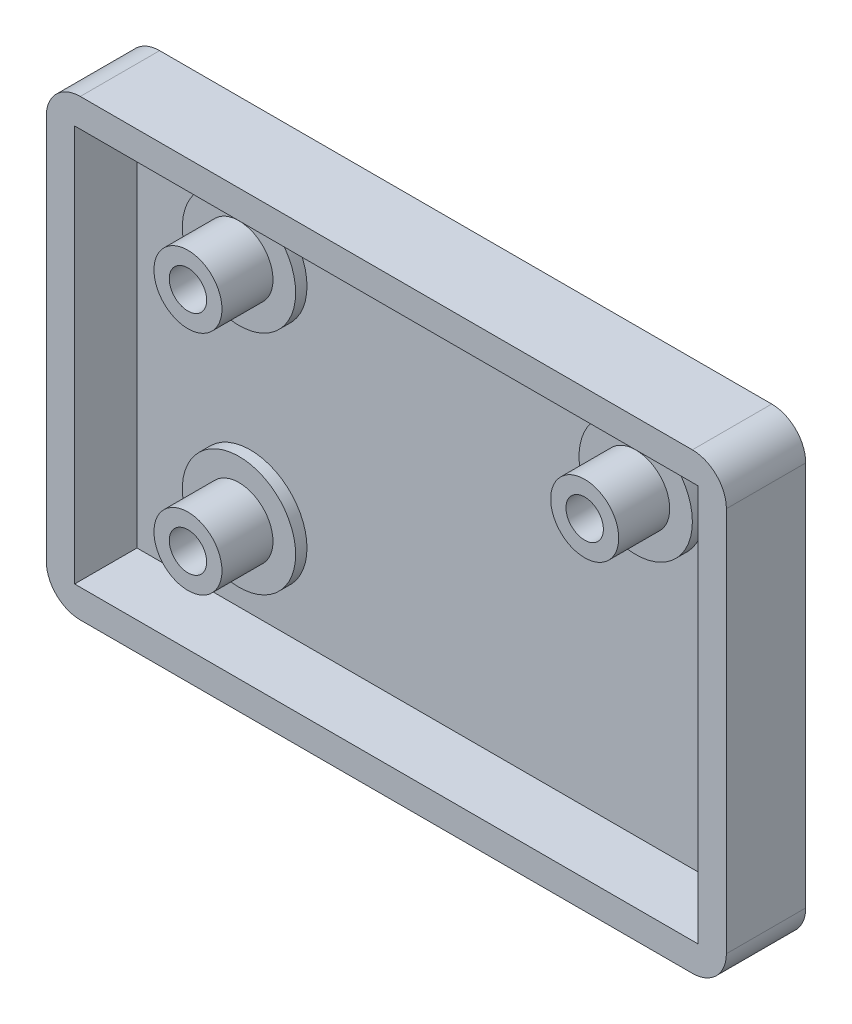
from build123d import *

# Parameters (mm, degrees)
CROQUIS1_W              = 60
CROQUIS1_H              = 40
SALIENTE_EXTRUIR1_DEPTH = 7
CROQUIS2_W              = 55
CROQUIS2_H              = 35
CORTAR_EXTRUIR1_DEPTH   = 5.5
REDONDEO1_R             = 3
CROQUIS3_R              = 1.65
CORTAR_EXTRUIR2_DEPTH   = 30.5
CROQUIS5_R              = 5
CROQUIS5_R_2            = 1.65
SALIENTE_EXTRUIR2_DEPTH = 1
CROQUIS6_R              = 3
CROQUIS6_R_2            = 1.65
SALIENTE_EXTRUIR3_DEPTH = 4.5


with BuildPart() as part:
    # Croquis1 → Saliente-Extruir1 (new body)
    with BuildSketch(Plane.XY):
        Rectangle(CROQUIS1_W, CROQUIS1_H)
    extrude(amount=SALIENTE_EXTRUIR1_DEPTH)

    # Croquis2 → Cortar-Extruir1 (cut)
    with BuildSketch(Plane.XY.offset(7)):
        Rectangle(CROQUIS2_W, CROQUIS2_H)
    extrude(amount=-CORTAR_EXTRUIR1_DEPTH, mode=Mode.SUBTRACT)

    # Redondeo1
    redondeo1_edges = [part.edges().sort_by_distance(p)[0] for p in [
        (-30, 20, 3.5),
        (30, 20, 3.5),
        (30, -20, 3.5),
        (-30, -20, 3.5),
    ]]
    fillet(redondeo1_edges, radius=REDONDEO1_R)

    # Croquis3 → Cortar-Extruir2 (cut)
    with BuildSketch(Plane(origin=(0, 0, 0), x_dir=(-1, 0, 0), z_dir=(0, 0, -1))):
        with Locations((-17.5, 10)):
            Circle(CROQUIS3_R)
        with Locations((17.5, 10)):
            Circle(CROQUIS3_R)
        with Locations((17.5, -10)):
            Circle(CROQUIS3_R)
    extrude(amount=-CORTAR_EXTRUIR2_DEPTH, mode=Mode.SUBTRACT)

    # Croquis5 → Saliente-Extruir2 (add)
    # profile 1 of 3: a face of its own
    with BuildSketch(Plane.XY.offset(1.5)):
        with Locations((-17.5, 10)):
            Circle(CROQUIS5_R)
        with Locations(Location((-17.5, 10, 0), (0, 0, 180))):
            Circle(CROQUIS5_R_2, mode=Mode.SUBTRACT)
    # profile 2 of 3: a face of its own
    with BuildSketch(Plane.XY.offset(1.5)):
        with Locations((17.5, 10)):
            Circle(CROQUIS5_R)
        with Locations(Location((17.5, 10, 0), (0, 0, 180))):
            Circle(CROQUIS5_R_2, mode=Mode.SUBTRACT)
    # profile 3 of 3: a face of its own
    with BuildSketch(Plane.XY.offset(1.5)):
        with Locations((-17.5, -10)):
            Circle(CROQUIS5_R)
        with Locations(Location((-17.5, -10, 0), (0, 0, 180))):
            Circle(CROQUIS5_R_2, mode=Mode.SUBTRACT)
    extrude(amount=SALIENTE_EXTRUIR2_DEPTH)

    # Croquis6 → Saliente-Extruir3 (add)
    # profile 1 of 3: a face of its own
    with BuildSketch(Plane.XY.offset(2.5)):
        with Locations((-17.5, 10)):
            Circle(CROQUIS6_R)
        with Locations(Location((-17.5, 10, 0), (0, 0, 180))):
            Circle(CROQUIS6_R_2, mode=Mode.SUBTRACT)
    # profile 2 of 3: a face of its own
    with BuildSketch(Plane.XY.offset(2.5)):
        with Locations((17.5, 10)):
            Circle(CROQUIS6_R)
        with Locations(Location((17.5, 10, 0), (0, 0, 180))):
            Circle(CROQUIS6_R_2, mode=Mode.SUBTRACT)
    # profile 3 of 3: a face of its own
    with BuildSketch(Plane.XY.offset(2.5)):
        with Locations((-17.5, -10)):
            Circle(CROQUIS6_R)
        with Locations(Location((-17.5, -10, 0), (0, 0, 180))):
            Circle(CROQUIS6_R_2, mode=Mode.SUBTRACT)
    extrude(amount=SALIENTE_EXTRUIR3_DEPTH)


solid = part.part
